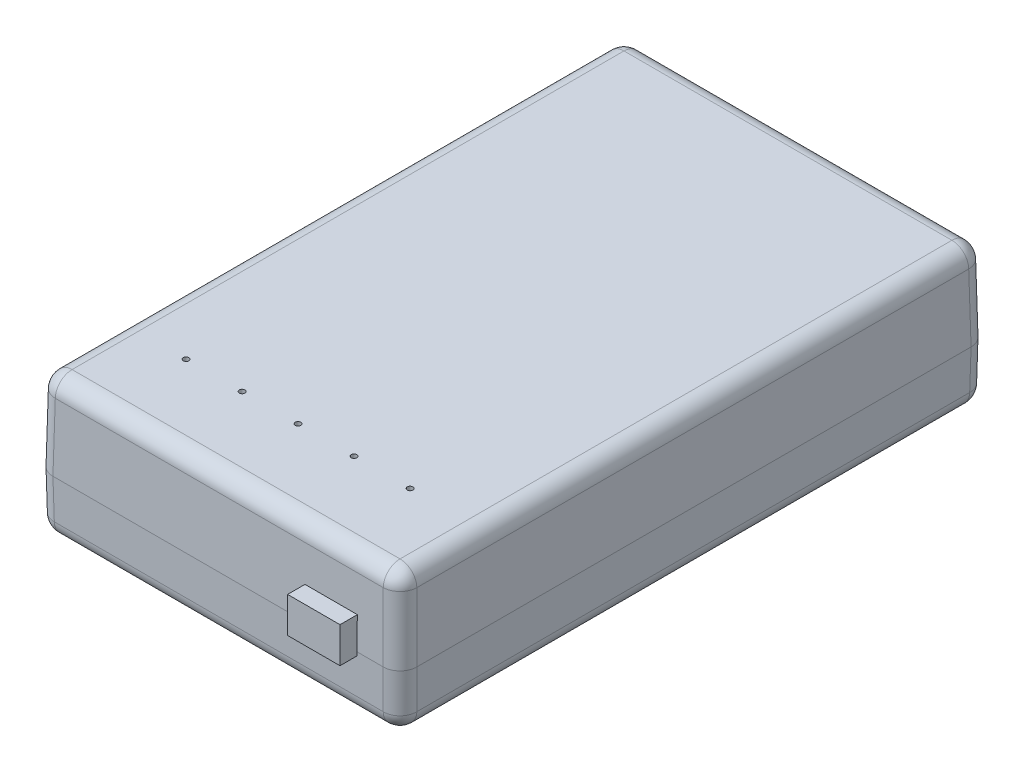
from build123d import *

# Parameters (mm, degrees)
SKETCH1_W                     = 65
SKETCH1_H                     = 105
BOSS_EXTRUDE1_DEPTH           = 15
BOSS_EXTRUDE1_TAPER           = 1
BOSS_EXTRUDE1_OTHER_WAY_DEPTH = 10
BOSS_EXTRUDE1_OTHER_WAY_TAPER = 1
FILLET1_R                     = 3
BOSS_EXTRUDE2_DEPTH           = 3
BOSS_EXTRUDE2_DEPTH_BACK      = 3
BOSS_EXTRUDE2_START           = 52.5
SKETCH3_W                     = 9.357586106
SKETCH3_H                     = 6.356143016
SKETCH5_R                     = 0.5
CUT_EXTRUDE1_DEPTH            = 3


with BuildPart() as part:
    # Sketch1 → Boss-Extrude1 (new body)
    with BuildSketch(Plane(origin=(0, 0, 0), x_dir=(1, 0, 0), z_dir=(0, 1, 0))):
        Rectangle(SKETCH1_W, SKETCH1_H)
    extrude(amount=BOSS_EXTRUDE1_DEPTH, taper=BOSS_EXTRUDE1_TAPER)

    # Sketch1 → Boss-Extrude1 other way (add)
    with BuildSketch(Plane(origin=(0, 0, 0), x_dir=(1, 0, 0), z_dir=(0, 1, 0))):
        Rectangle(SKETCH1_W, SKETCH1_H)
    extrude(amount=-BOSS_EXTRUDE1_OTHER_WAY_DEPTH, taper=BOSS_EXTRUDE1_OTHER_WAY_TAPER)

    # Fillet1
    fillet1_edges = [part.edges().sort_by_distance(p)[0] for p in [
        (-32.325449351, -10, 0),
        (0, -10, 52.325449351),
        (32.369087013, 7.5, 52.369087013),
        (32.369087013, 7.5, -52.369087013),
        (-32.369087013, 7.5, -52.369087013),
        (-32.369087013, 7.5, 52.369087013),
        (32.238174026, 15, 0),
        (0, 15, -52.238174026),
        (-32.238174026, 15, 0),
        (0, 15, 52.238174026),
        (32.325449351, -10, 0),
        (0, -10, -52.325449351),
        (32.412724675, -5, 52.412724675),
        (-32.412724675, -5, 52.412724675),
        (-32.412724675, -5, -52.412724675),
        (32.412724675, -5, -52.412724675),
    ]]
    fillet(fillet1_edges, radius=FILLET1_R)

    # Sketch3 → Boss-Extrude2 (add, two sides: drawn at the far end of the back side and taken through both)
    with BuildSketch(Plane.XY.offset(BOSS_EXTRUDE2_START - BOSS_EXTRUDE2_DEPTH_BACK)):
        with Locations((20.097339375, 2.5)):
            Rectangle(SKETCH3_W, SKETCH3_H)
    extrude(amount=BOSS_EXTRUDE2_DEPTH + BOSS_EXTRUDE2_DEPTH_BACK)

    # Sketch5 → Cut-Extrude1 (cut)
    with BuildSketch(Plane(origin=(0, 15, 0), x_dir=(1, 0, 0), z_dir=(0, 1, 0))):
        with Locations(Location((19.290082237, -37.5, 0), (0, 0, 270))):
            Circle(SKETCH5_R)
        with Locations(Location((9.290082237, -37.5, 0), (0, 0, 270))):
            Circle(SKETCH5_R)
        with Locations(Location((-0.709917763, -37.5, 0), (0, 0, 270))):
            Circle(SKETCH5_R)
        with Locations(Location((-10.709917763, -37.5, 0), (0, 0, 270))):
            Circle(SKETCH5_R)
        with Locations(Location((-20.709917763, -37.5, 0), (0, 0, 270))):
            Circle(SKETCH5_R)
    extrude(amount=-CUT_EXTRUDE1_DEPTH, mode=Mode.SUBTRACT)


solid = part.part
